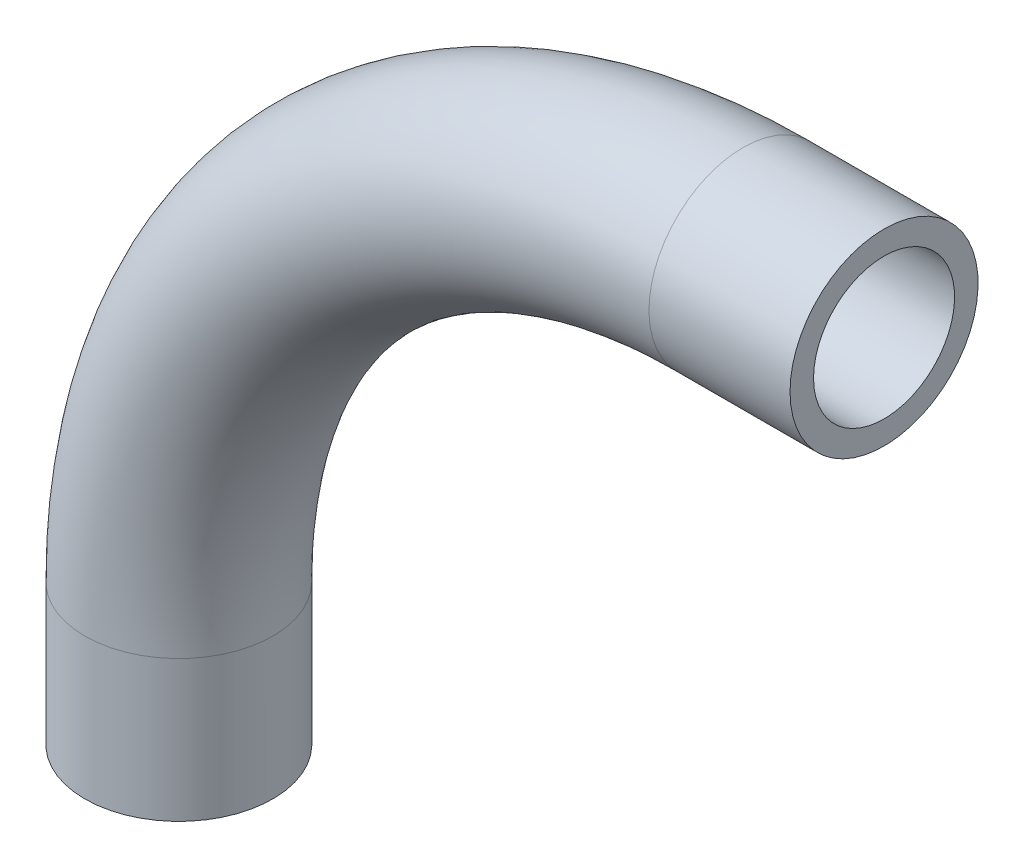
from build123d import *

# Parameters (mm, degrees)
SKETCH2_R   = 4
SKETCH2_R_2 = 3


with BuildPart() as part:
    # Sweep1: sweep along a path in Sketch1
    with BuildLine(Plane.XY) as sweep1_path:
        Line((0, 0), (0, 6))
        ThreePointArc((0, 6), (7.029437252, 22.970562748), (24, 30))
        Line((24, 30), (30, 30))
    # Sketch2 → Sweep1 (sweep)
    with BuildSketch(Plane(origin=(0, 0, 0), x_dir=(1, 0, 0), z_dir=(0, 1, 0))):
        Circle(SKETCH2_R)
        Circle(SKETCH2_R_2, mode=Mode.SUBTRACT)
    sweep(path=sweep1_path.line)


solid = part.part
